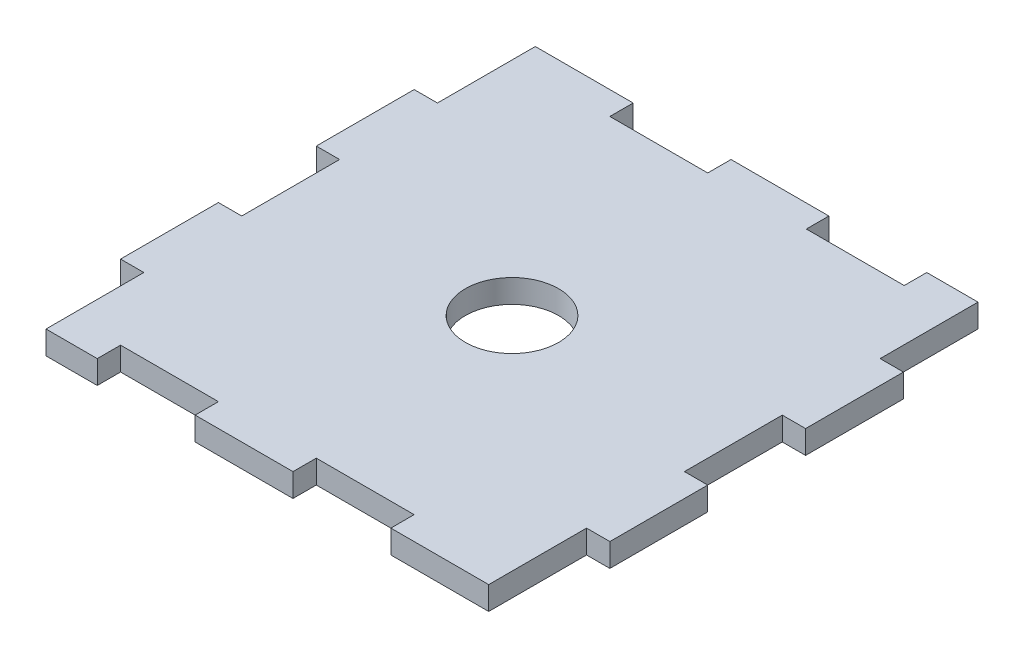
from build123d import *

# Parameters (mm, degrees)
BOSS_EXTRUDE1_DEPTH = 4.7625
SKETCH3_R           = 9.525
CUT_EXTRUDE1_DEPTH  = 4.7625


with BuildPart() as part:
    # Sketch2 → Boss-Extrude1 (new body)
    with BuildSketch(Plane(origin=(0, 100, 0), x_dir=(1, 0, 0), z_dir=(0, 1, 0))):
        Polygon((80, 100), (80, 95.392875), (60, 95.392875), (60, 100), (40, 100), (40, 95.2375), (20, 95.2375), (20, 100), (0, 100), (0, 80), (-4.7625, 80), (-4.7625, 60), (0, 60), (0, 40), (-4.7625, 40), (-4.7625, 20), (0, 20), (0, 0), (10.475, 0), (10.475, 4.7625), (30.475, 4.7625), (30.475, 0), (50.475, 0), (50.475, 4.7625), (70.475, 4.7625), (70.475, 0), (90.475, 0), (90.475, 20), (95.2375, 20), (95.2375, 40), (90.475, 40), (90.475, 60), (95.2375, 60), (95.2375, 80), (90.475, 80), (90.475, 100), align=None)
    extrude(amount=-BOSS_EXTRUDE1_DEPTH)

    # Sketch3 → Cut-Extrude1 (cut)
    with BuildSketch(Plane(origin=(0, 100, 0), x_dir=(1, 0, 0), z_dir=(0, 1, 0))):
        with Locations(Location((45.2375, 50, 0), (0, 0, 270))):
            Circle(SKETCH3_R)
    extrude(amount=-CUT_EXTRUDE1_DEPTH, mode=Mode.SUBTRACT)


solid = part.part
